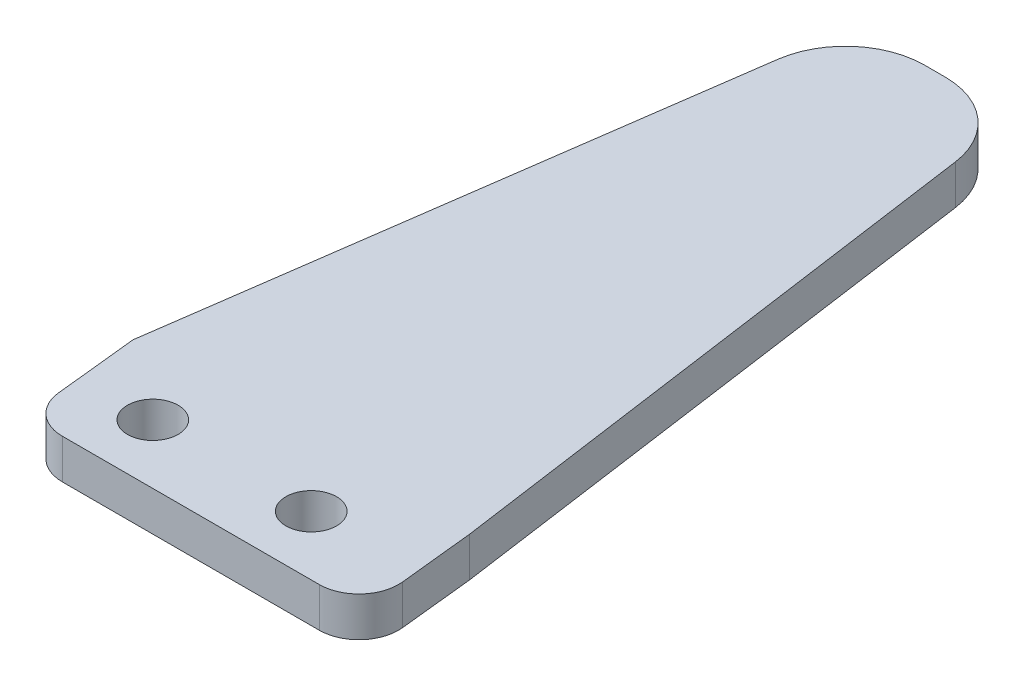
from build123d import *

# Parameters (mm, degrees)
SKETCH1_R           = 2.032
BOSS_EXTRUDE1_DEPTH = 3.175
FILLET1_R           = 6.35
FILLET2_R           = 3.175


with BuildPart() as part:
    # Sketch1 → Boss-Extrude1 (new body)
    with BuildSketch(Plane(origin=(0, 0, 0), x_dir=(1, 0, 0), z_dir=(0, 1, 0))):
        Polygon((44.45, 9.525), (45.451117841, 0), (72.438617841, 0), (71.4375, 9.525), (64.29375, 60.325), (51.59375, 60.325), align=None)
        with Locations(Location((50.8, 4.7625, 0), (0, 0, 270))):
            Circle(SKETCH1_R, mode=Mode.SUBTRACT)
        with Locations(Location((63.5, 4.7625, 0), (0, 0, 270))):
            Circle(SKETCH1_R, mode=Mode.SUBTRACT)
    extrude(amount=BOSS_EXTRUDE1_DEPTH)

    # Fillet1
    fillet1_edges = [part.edges().sort_by_distance(p)[0] for p in [
        (51.59375, 1.5875, -60.325),
        (64.29375, 1.5875, -60.325),
    ]]
    fillet(fillet1_edges, radius=FILLET1_R)

    # Fillet2
    fillet2_edges = [part.edges().sort_by_distance(p)[0] for p in [
        (72.438617841, 1.5875, 0),
        (45.451117841, 1.5875, 0),
    ]]
    fillet(fillet2_edges, radius=FILLET2_R)


solid = part.part
